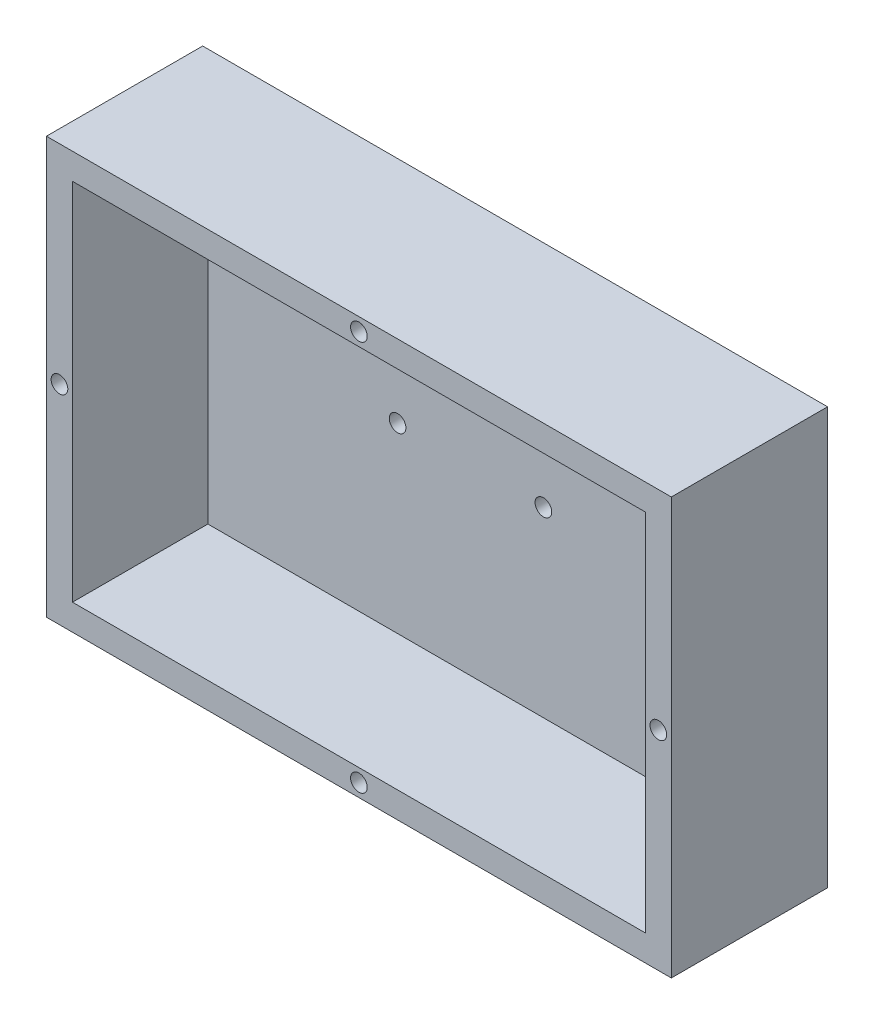
from build123d import *

# Parameters (mm, degrees)
SKETCH1_W           = 76.2
SKETCH1_H           = 50.8
BOSS_EXTRUDE1_DEPTH = 19.05
SKETCH2_W           = 34.925
SKETCH2_H           = 44.45
CUT_EXTRUDE1_DEPTH  = 16.51
SKETCH4_R           = 1.016
CUT_EXTRUDE4_DEPTH  = 5.08
SKETCH6_R           = 1.016
CUT_EXTRUDE6_DEPTH  = 94.057294717


with BuildPart() as part:
    # Sketch1 → Boss-Extrude1 (new body)
    with BuildSketch(Plane.XY):
        with Locations((38.1, 25.4)):
            Rectangle(SKETCH1_W, SKETCH1_H)
    extrude(amount=BOSS_EXTRUDE1_DEPTH)

    # Sketch2 → Cut-Extrude1 (cut)
    with BuildSketch(Plane.XY.offset(19.05)):
        with Locations((55.5625, 25.4)):
            Rectangle(SKETCH2_W, SKETCH2_H)
        with Locations((20.6375, 25.4)):
            Rectangle(SKETCH2_W, SKETCH2_H)
    extrude(amount=-CUT_EXTRUDE1_DEPTH, mode=Mode.SUBTRACT)

    # Sketch4 → Cut-Extrude4 (cut)
    with BuildSketch(Plane.XY.offset(19.05)):
        with Locations((1.5875, 25.4)):
            Circle(SKETCH4_R)
        with Locations((38.1, 49.2125)):
            Circle(SKETCH4_R)
        with Locations((74.6125, 25.4)):
            Circle(SKETCH4_R)
        with Locations((38.1, 1.5875)):
            Circle(SKETCH4_R)
    extrude(amount=-CUT_EXTRUDE4_DEPTH, mode=Mode.SUBTRACT)

    # Sketch6 → Cut-Extrude6 (cut, through all)
    with BuildSketch(Plane.XY.offset(2.54)):
        with Locations((26.310023895, 25.4)):
            Circle(SKETCH6_R)
        with Locations((44.090023895, 25.4)):
            Circle(SKETCH6_R)
    extrude(amount=-CUT_EXTRUDE6_DEPTH, mode=Mode.SUBTRACT)


solid = part.part
